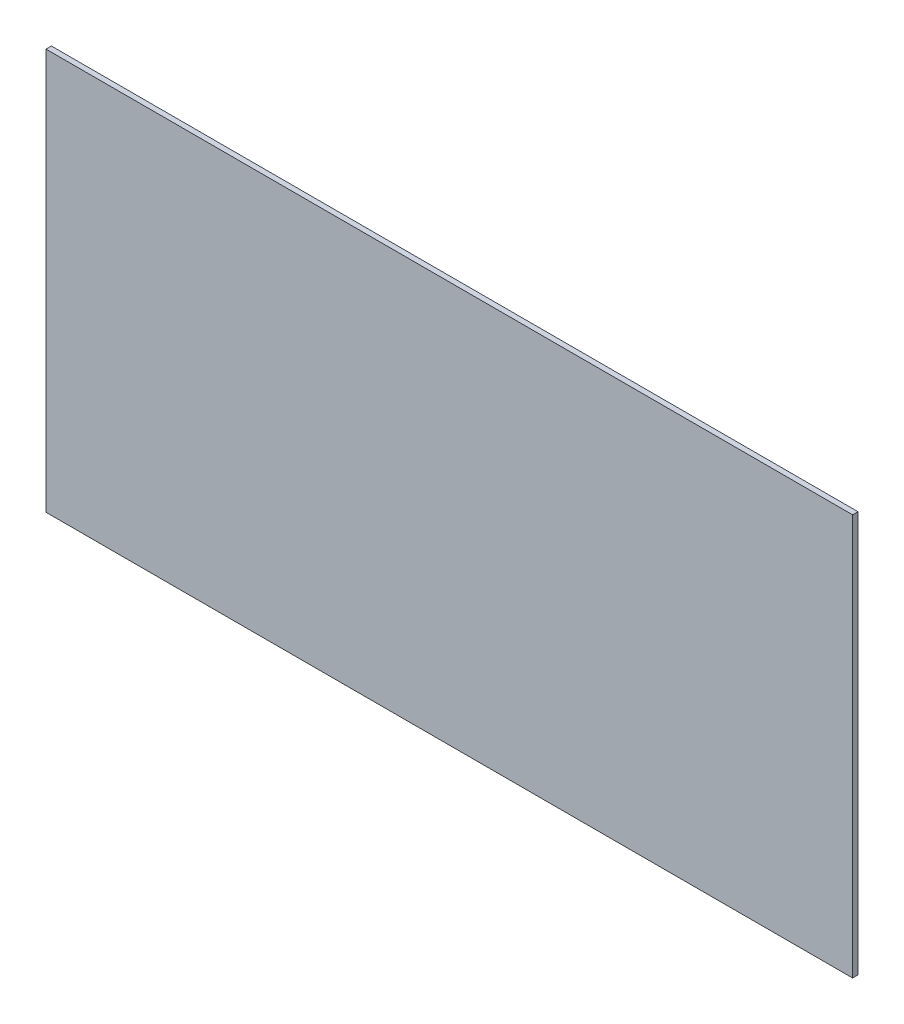
from build123d import *

# Parameters (mm, degrees)
SKETCH_1_W      = 1498
SKETCH_1_H      = 745
EXTRUDE_1_DEPTH = 10


with BuildPart() as part:
    # Эскиз1 → Бобышка-Вытянуть1 (new body)
    with BuildSketch(Plane.XY):
        with Locations((749, 372.5)):
            Rectangle(SKETCH_1_W, SKETCH_1_H)
    extrude(amount=EXTRUDE_1_DEPTH)


solid = part.part
